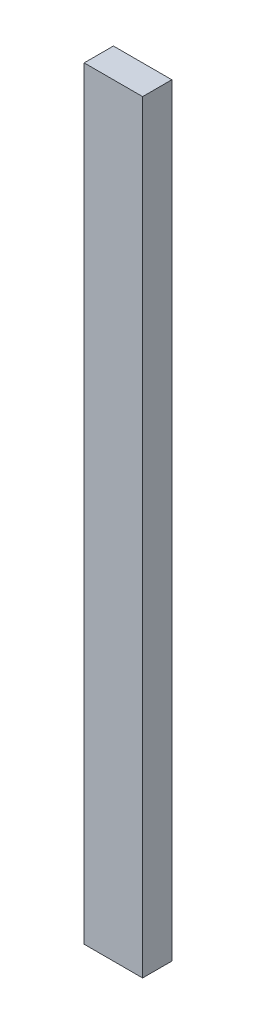
from build123d import *

# Parameters (mm, degrees)
ESQUISSE1_W        = 48
ESQUISSE1_H        = 627
BOSS_EXTRU_1_DEPTH = 24


with BuildPart() as part:
    # Esquisse1 → Boss.-Extru.1 (new body)
    with BuildSketch(Plane.XY):
        Rectangle(ESQUISSE1_W, ESQUISSE1_H)
    extrude(amount=BOSS_EXTRU_1_DEPTH)


solid = part.part
